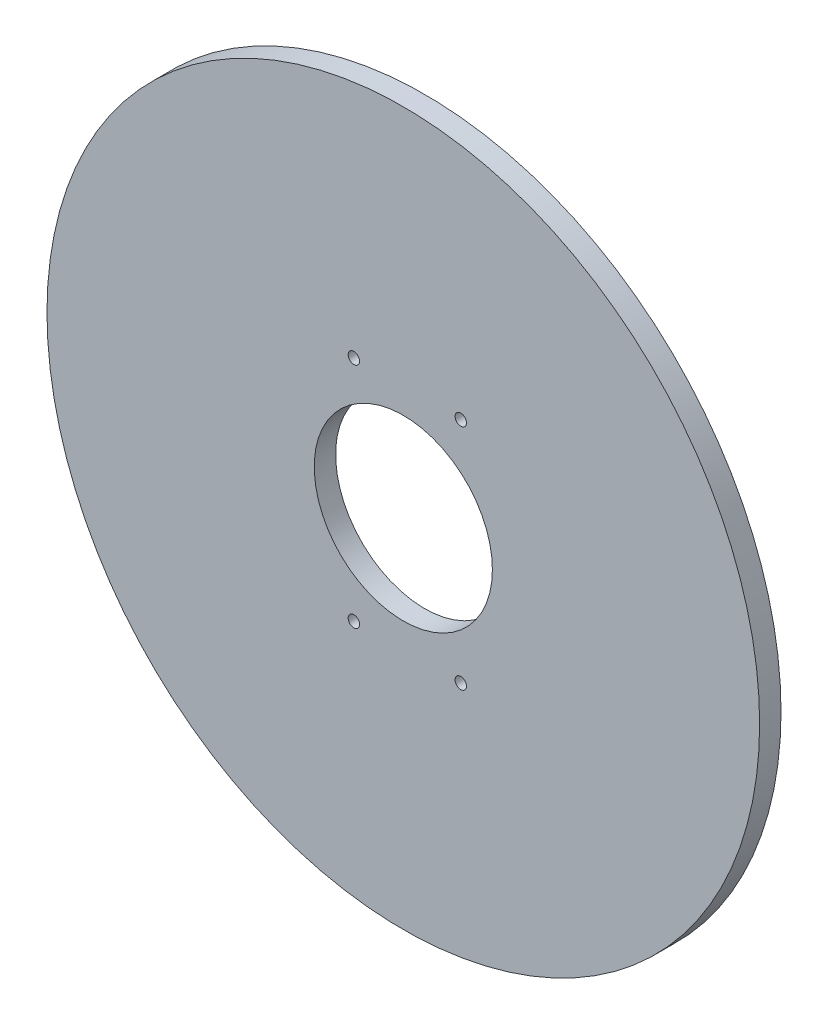
from build123d import *

# Parameters (mm, degrees)
SKETCH1_R           = 100
SKETCH1_R_2         = 25
BOSS_EXTRUDE1_DEPTH = 6
SKETCH2_R           = 1.6
CUT_EXTRUDE1_DEPTH  = 142.548578234


with BuildPart() as part:
    # Sketch1 → Boss-Extrude1 (new body)
    with BuildSketch(Plane.XY):
        Circle(SKETCH1_R)
        Circle(SKETCH1_R_2, mode=Mode.SUBTRACT)
    extrude(amount=BOSS_EXTRUDE1_DEPTH)

    # Sketch2 → Cut-Extrude1 (cut, through all)
    with BuildSketch(Plane(origin=(0, 0, 0), x_dir=(-1, 0, 0), z_dir=(0, 0, -1))):
        with Locations((-16.129709466, 32)):
            Circle(SKETCH2_R)
        with Locations((13.870290534, 32)):
            Circle(SKETCH2_R)
        with Locations(Location((13.870290534, -32, 0), (0, 0, 180))):
            Circle(SKETCH2_R)
        with Locations(Location((-16.129709466, -32, 0), (0, 0, 180))):
            Circle(SKETCH2_R)
    extrude(amount=-CUT_EXTRUDE1_DEPTH, mode=Mode.SUBTRACT)


solid = part.part
